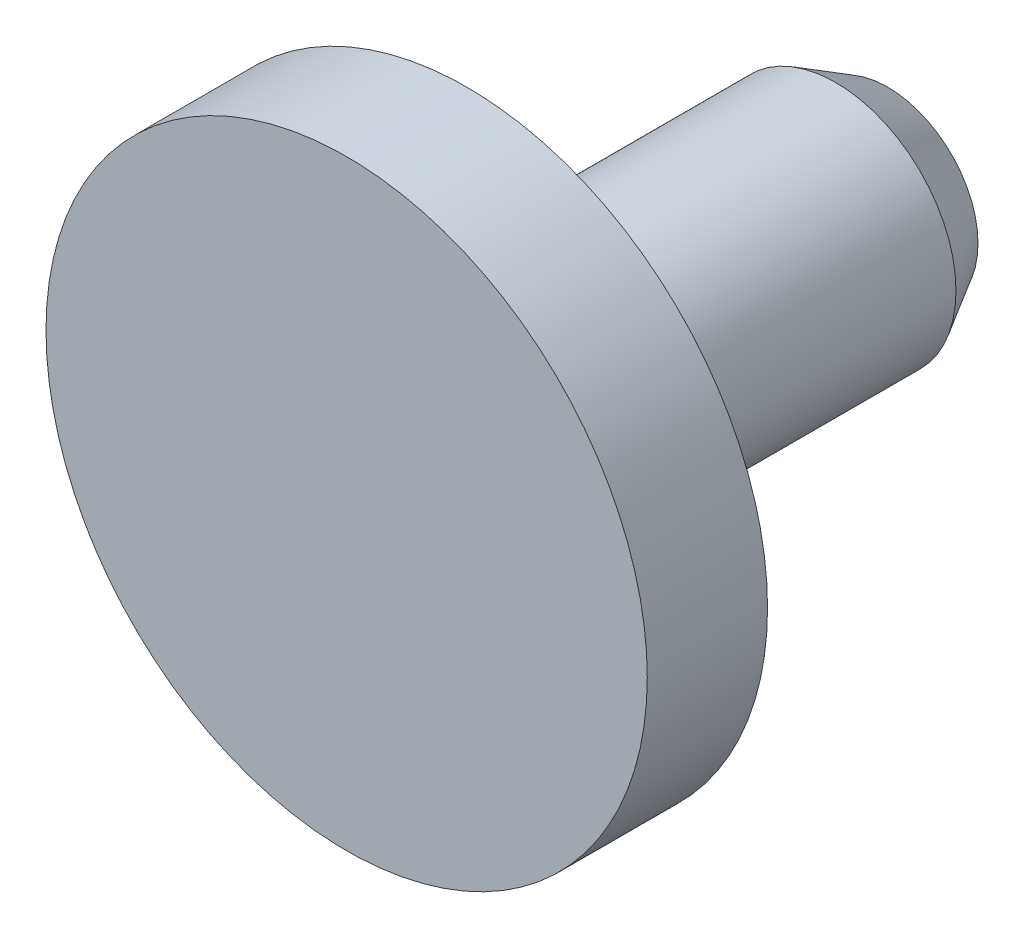
from build123d import *

# Parameters (mm, degrees)
CROQUIS1_R              = 5
SALIENTE_EXTRUIR1_DEPTH = 2
CROQUIS2_R              = 2
SALIENTE_EXTRUIR2_DEPTH = 7
CHAFL_N1_SIZE           = 0.5
CHAFL_N1_SIZE2          = 0.866025404


with BuildPart() as part:
    # Croquis1 → Saliente-Extruir1 (new body)
    with BuildSketch(Plane.XY):
        Circle(CROQUIS1_R)
    extrude(amount=SALIENTE_EXTRUIR1_DEPTH)

    # Croquis2 → Saliente-Extruir2 (add)
    with BuildSketch(Plane.XY):
        Circle(CROQUIS2_R)
    extrude(amount=-SALIENTE_EXTRUIR2_DEPTH)

    # Chaflán1
    chafl_n1_edges = [part.edges().sort_by_distance(p)[0] for p in [
        (-2, 0, -7),
    ]]
    chafl_n1_side = [part.faces().sort_by_distance(p)[0] for p in [
        (0, 0, -7),
    ]]
    chamfer(chafl_n1_edges, length=CHAFL_N1_SIZE, length2=CHAFL_N1_SIZE2, reference=chafl_n1_side[0])


solid = part.part
